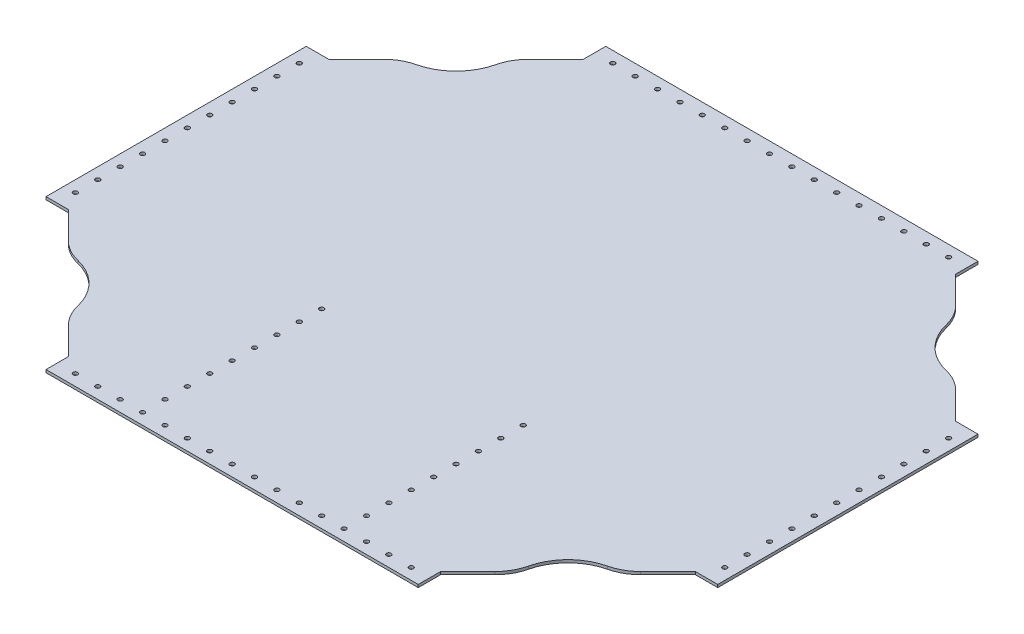
from build123d import *

# Parameters (mm, degrees)
SKETCH2_R           = 2.5527
BOSS_EXTRUDE1_DEPTH = 3.175


with BuildPart() as part:
    # Sketch2 → Boss-Extrude1 (new body)
    with BuildSketch(Plane(origin=(0, 0, 0), x_dir=(1, 0, 0), z_dir=(0, 1, 0))):
        with BuildLine():
            Line((-381, -147.6375), (-381, 147.6375))
            Line((-381, 147.6375), (-355.6, 147.6375))
            Line((-355.6, 147.6375), (-324.621785889, 178.615714111))
            ThreePointArc((-324.621785889, 178.615714111), (-313.457624236, 187.053879686), (-300.414699048, 192.125688655))
            ThreePointArc((-300.414699048, 192.125688655), (-271.668783425, 208.168783425), (-255.625688655, 236.914699048))
            ThreePointArc((-255.625688655, 236.914699048), (-250.553879686, 249.957624236), (-242.115714111, 261.121785889))
            Line((-242.115714111, 261.121785889), (-211.1375, 292.1))
            Line((-211.1375, 292.1), (-211.1375, 317.5))
            Line((-211.1375, 317.5), (211.1375, 317.5))
            Line((211.1375, 317.5), (211.1375, 292.1))
            Line((211.1375, 292.1), (242.115714111, 261.121785889))
            ThreePointArc((242.115714111, 261.121785889), (250.553879686, 249.957624236), (255.625688655, 236.914699048))
            ThreePointArc((255.625688655, 236.914699048), (271.668783425, 208.168783425), (300.414699048, 192.125688655))
            ThreePointArc((300.414699048, 192.125688655), (313.457624236, 187.053879686), (324.621785889, 178.615714111))
            Line((324.621785889, 178.615714111), (355.6, 147.6375))
            Line((355.6, 147.6375), (381, 147.6375))
            Line((381, 147.6375), (381, -147.6375))
            Line((381, -147.6375), (355.6, -147.6375))
            Line((355.6, -147.6375), (324.621785889, -178.615714111))
            ThreePointArc((324.621785889, -178.615714111), (313.457624236, -187.053879686), (300.414699048, -192.125688655))
            ThreePointArc((300.414699048, -192.125688655), (271.668783425, -208.168783425), (255.625688655, -236.914699048))
            ThreePointArc((255.625688655, -236.914699048), (250.553879686, -249.957624236), (242.115714111, -261.121785889))
            Line((242.115714111, -261.121785889), (211.1375, -292.1))
            Line((211.1375, -292.1), (211.1375, -317.5))
            Line((211.1375, -317.5), (-101.6, -317.5))
            Line((-101.6, -317.5), (-211.1375, -317.5))
            Line((-211.1375, -317.5), (-211.1375, -292.1))
            Line((-211.1375, -292.1), (-242.115714111, -261.121785889))
            ThreePointArc((-242.115714111, -261.121785889), (-250.553879686, -249.957624236), (-255.625688655, -236.914699048))
            ThreePointArc((-255.625688655, -236.914699048), (-271.668783425, -208.168783425), (-300.414699048, -192.125688655))
            ThreePointArc((-300.414699048, -192.125688655), (-313.457624236, -187.053879686), (-324.621785889, -178.615714111))
            Line((-324.621785889, -178.615714111), (-355.6, -147.6375))
            Line((-355.6, -147.6375), (-381, -147.6375))
        make_face()
        with Locations(Location((-190.5, 304.8, 0), (0, 0, 270))):
            Circle(SKETCH2_R, mode=Mode.SUBTRACT)
        with Locations(Location((-165.1, 304.8, 0), (0, 0, 270))):
            Circle(SKETCH2_R, mode=Mode.SUBTRACT)
        with Locations(Location((-139.7, 304.8, 0), (0, 0, 270))):
            Circle(SKETCH2_R, mode=Mode.SUBTRACT)
        with Locations(Location((-114.3, 304.8, 0), (0, 0, 270))):
            Circle(SKETCH2_R, mode=Mode.SUBTRACT)
        with Locations(Location((-88.9, 304.8, 0), (0, 0, 270))):
            Circle(SKETCH2_R, mode=Mode.SUBTRACT)
        with Locations(Location((-63.5, 304.8, 0), (0, 0, 270))):
            Circle(SKETCH2_R, mode=Mode.SUBTRACT)
        with Locations(Location((-38.1, 304.8, 0), (0, 0, 270))):
            Circle(SKETCH2_R, mode=Mode.SUBTRACT)
        with Locations(Location((-12.7, 304.8, 0), (0, 0, 270))):
            Circle(SKETCH2_R, mode=Mode.SUBTRACT)
        with Locations(Location((12.7, 304.8, 0), (0, 0, 270))):
            Circle(SKETCH2_R, mode=Mode.SUBTRACT)
        with Locations(Location((38.1, 304.8, 0), (0, 0, 270))):
            Circle(SKETCH2_R, mode=Mode.SUBTRACT)
        with Locations(Location((63.5, 304.8, 0), (0, 0, 270))):
            Circle(SKETCH2_R, mode=Mode.SUBTRACT)
        with Locations(Location((88.9, 304.8, 0), (0, 0, 270))):
            Circle(SKETCH2_R, mode=Mode.SUBTRACT)
        with Locations(Location((114.3, 304.8, 0), (0, 0, 270))):
            Circle(SKETCH2_R, mode=Mode.SUBTRACT)
        with Locations(Location((139.7, 304.8, 0), (0, 0, 270))):
            Circle(SKETCH2_R, mode=Mode.SUBTRACT)
        with Locations(Location((368.3, 127, 0), (0, 0, 270))):
            Circle(SKETCH2_R, mode=Mode.SUBTRACT)
        with Locations(Location((368.3, 101.6, 0), (0, 0, 270))):
            Circle(SKETCH2_R, mode=Mode.SUBTRACT)
        with Locations(Location((368.3, 76.2, 0), (0, 0, 270))):
            Circle(SKETCH2_R, mode=Mode.SUBTRACT)
        with Locations(Location((368.3, 50.8, 0), (0, 0, 270))):
            Circle(SKETCH2_R, mode=Mode.SUBTRACT)
        with Locations(Location((368.3, 25.4, 0), (0, 0, 270))):
            Circle(SKETCH2_R, mode=Mode.SUBTRACT)
        with Locations(Location((368.3, 0, 0), (0, 0, 270))):
            Circle(SKETCH2_R, mode=Mode.SUBTRACT)
        with Locations(Location((368.3, -25.4, 0), (0, 0, 270))):
            Circle(SKETCH2_R, mode=Mode.SUBTRACT)
        with Locations(Location((368.3, -50.8, 0), (0, 0, 270))):
            Circle(SKETCH2_R, mode=Mode.SUBTRACT)
        with Locations(Location((368.3, -76.2, 0), (0, 0, 270))):
            Circle(SKETCH2_R, mode=Mode.SUBTRACT)
        with Locations(Location((139.7, -304.8, 0), (0, 0, 90))):
            Circle(SKETCH2_R, mode=Mode.SUBTRACT)
        with Locations(Location((114.3, -304.8, 0), (0, 0, 90))):
            Circle(SKETCH2_R, mode=Mode.SUBTRACT)
        with Locations(Location((-114.3, -304.8, 0), (0, 0, 90))):
            Circle(SKETCH2_R, mode=Mode.SUBTRACT)
        with Locations(Location((-139.7, -304.8, 0), (0, 0, 90))):
            Circle(SKETCH2_R, mode=Mode.SUBTRACT)
        with Locations(Location((-165.1, -304.8, 0), (0, 0, 90))):
            Circle(SKETCH2_R, mode=Mode.SUBTRACT)
        with Locations(Location((-190.5, -304.8, 0), (0, 0, 90))):
            Circle(SKETCH2_R, mode=Mode.SUBTRACT)
        with Locations(Location((-368.3, -76.2, 0), (0, 0, 90))):
            Circle(SKETCH2_R, mode=Mode.SUBTRACT)
        with Locations(Location((-368.3, -50.8, 0), (0, 0, 90))):
            Circle(SKETCH2_R, mode=Mode.SUBTRACT)
        with Locations(Location((-368.3, -25.4, 0), (0, 0, 90))):
            Circle(SKETCH2_R, mode=Mode.SUBTRACT)
        with Locations(Location((-368.3, 0, 0), (0, 0, 90))):
            Circle(SKETCH2_R, mode=Mode.SUBTRACT)
        with Locations(Location((-368.3, 25.4, 0), (0, 0, 90))):
            Circle(SKETCH2_R, mode=Mode.SUBTRACT)
        with Locations(Location((-368.3, 50.8, 0), (0, 0, 90))):
            Circle(SKETCH2_R, mode=Mode.SUBTRACT)
        with Locations(Location((-368.3, 76.2, 0), (0, 0, 90))):
            Circle(SKETCH2_R, mode=Mode.SUBTRACT)
        with Locations(Location((-368.3, 101.6, 0), (0, 0, 90))):
            Circle(SKETCH2_R, mode=Mode.SUBTRACT)
        with Locations(Location((-368.3, 127, 0), (0, 0, 90))):
            Circle(SKETCH2_R, mode=Mode.SUBTRACT)
        with Locations(Location((-114.3, -279.4, 0), (0, 0, 270))):
            Circle(SKETCH2_R, mode=Mode.SUBTRACT)
        with Locations(Location((-114.3, -254, 0), (0, 0, 270))):
            Circle(SKETCH2_R, mode=Mode.SUBTRACT)
        with Locations(Location((-114.3, -228.6, 0), (0, 0, 270))):
            Circle(SKETCH2_R, mode=Mode.SUBTRACT)
        with Locations(Location((-114.3, -203.2, 0), (0, 0, 270))):
            Circle(SKETCH2_R, mode=Mode.SUBTRACT)
        with Locations(Location((-114.3, -177.8, 0), (0, 0, 270))):
            Circle(SKETCH2_R, mode=Mode.SUBTRACT)
        with Locations(Location((-114.3, -152.4, 0), (0, 0, 270))):
            Circle(SKETCH2_R, mode=Mode.SUBTRACT)
        with Locations(Location((-114.3, -127, 0), (0, 0, 270))):
            Circle(SKETCH2_R, mode=Mode.SUBTRACT)
        with Locations(Location((-114.3, -101.6, 0), (0, 0, 270))):
            Circle(SKETCH2_R, mode=Mode.SUBTRACT)
        with Locations(Location((114.3, -279.4, 0), (0, 0, 90))):
            Circle(SKETCH2_R, mode=Mode.SUBTRACT)
        with Locations(Location((114.3, -254, 0), (0, 0, 90))):
            Circle(SKETCH2_R, mode=Mode.SUBTRACT)
        with Locations(Location((114.3, -228.6, 0), (0, 0, 90))):
            Circle(SKETCH2_R, mode=Mode.SUBTRACT)
        with Locations(Location((114.3, -203.2, 0), (0, 0, 90))):
            Circle(SKETCH2_R, mode=Mode.SUBTRACT)
        with Locations(Location((114.3, -177.8, 0), (0, 0, 90))):
            Circle(SKETCH2_R, mode=Mode.SUBTRACT)
        with Locations(Location((114.3, -152.4, 0), (0, 0, 90))):
            Circle(SKETCH2_R, mode=Mode.SUBTRACT)
        with Locations(Location((114.3, -127, 0), (0, 0, 90))):
            Circle(SKETCH2_R, mode=Mode.SUBTRACT)
        with Locations(Location((114.3, -101.6, 0), (0, 0, 90))):
            Circle(SKETCH2_R, mode=Mode.SUBTRACT)
        with Locations(Location((165.1, 304.8, 0), (0, 0, 270))):
            Circle(SKETCH2_R, mode=Mode.SUBTRACT)
        with Locations(Location((190.5, 304.8, 0), (0, 0, 270))):
            Circle(SKETCH2_R, mode=Mode.SUBTRACT)
        with Locations(Location((368.3, -101.6, 0), (0, 0, 270))):
            Circle(SKETCH2_R, mode=Mode.SUBTRACT)
        with Locations(Location((368.3, -127, 0), (0, 0, 270))):
            Circle(SKETCH2_R, mode=Mode.SUBTRACT)
        with Locations(Location((165.1, -304.8, 0), (0, 0, 90))):
            Circle(SKETCH2_R, mode=Mode.SUBTRACT)
        with Locations(Location((190.5, -304.8, 0), (0, 0, 90))):
            Circle(SKETCH2_R, mode=Mode.SUBTRACT)
        with Locations(Location((-368.3, -101.6, 0), (0, 0, 90))):
            Circle(SKETCH2_R, mode=Mode.SUBTRACT)
        with Locations(Location((-368.3, -127, 0), (0, 0, 90))):
            Circle(SKETCH2_R, mode=Mode.SUBTRACT)
        with Locations(Location((-88.9, -304.8, 0), (0, 0, 90))):
            Circle(SKETCH2_R, mode=Mode.SUBTRACT)
        with Locations(Location((-63.5, -304.8, 0), (0, 0, 90))):
            Circle(SKETCH2_R, mode=Mode.SUBTRACT)
        with Locations(Location((-38.1, -304.8, 0), (0, 0, 90))):
            Circle(SKETCH2_R, mode=Mode.SUBTRACT)
        with Locations(Location((-12.7, -304.8, 0), (0, 0, 90))):
            Circle(SKETCH2_R, mode=Mode.SUBTRACT)
        with Locations(Location((12.7, -304.8, 0), (0, 0, 90))):
            Circle(SKETCH2_R, mode=Mode.SUBTRACT)
        with Locations(Location((38.1, -304.8, 0), (0, 0, 90))):
            Circle(SKETCH2_R, mode=Mode.SUBTRACT)
        with Locations(Location((63.5, -304.8, 0), (0, 0, 90))):
            Circle(SKETCH2_R, mode=Mode.SUBTRACT)
        with Locations(Location((88.9, -304.8, 0), (0, 0, 90))):
            Circle(SKETCH2_R, mode=Mode.SUBTRACT)
    extrude(amount=BOSS_EXTRUDE1_DEPTH)


solid = part.part
